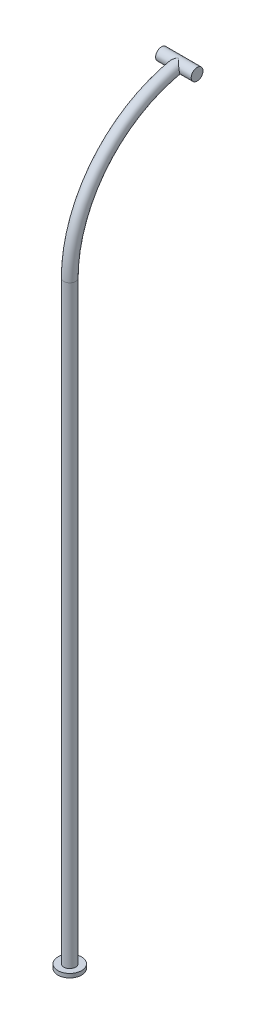
from build123d import *

# Parameters (mm, degrees)
SKETCH1_R                = 1.5
BOSS_EXTRUDE1_DEPTH      = 150
SKETCH4_R                = 3
BOSS_EXTRUDE4_DEPTH      = 1
SKETCH7_R                = 1.5
REVOLVE1_ANGLE           = 80
BOSS_EXTRUDE5_DEPTH      = 4.5
BOSS_EXTRUDE5_DEPTH_BACK = 4.5
SKETCH8_R                = 1.5


with BuildPart() as part:
    # Sketch1 → Boss-Extrude1 (new body)
    with BuildSketch(Plane(origin=(0, 0, 0), x_dir=(1, 0, 0), z_dir=(0, 1, 0))):
        Circle(SKETCH1_R)
    extrude(amount=BOSS_EXTRUDE1_DEPTH)

    # Sketch4 → Boss-Extrude4 (add)
    with BuildSketch(Plane.XZ):
        Circle(SKETCH4_R)
    extrude(amount=BOSS_EXTRUDE4_DEPTH)

    # Sketch7 → Revolve1 (revolve)
    with BuildSketch(Plane(origin=(0, 150, 0), x_dir=(1, 0, 0), z_dir=(0, 1, 0))):
        Circle(SKETCH7_R)
    revolve(axis=Axis((-42.510122648, 150, -33.5), (-1, 0, 0)), revolution_arc=REVOLVE1_ANGLE)

    # Sketch8 → Boss-Extrude5 (add, two sides: drawn at the far end of the back side and taken through both)
    with BuildSketch(Plane(origin=(0, 0, 0), x_dir=(0, 0, -1), z_dir=(1, 0, 0)).offset(-BOSS_EXTRUDE5_DEPTH_BACK)):
        with Locations((27.682786048, 182.991059726)):
            Circle(SKETCH8_R)
    extrude(amount=BOSS_EXTRUDE5_DEPTH + BOSS_EXTRUDE5_DEPTH_BACK)


solid = part.part
